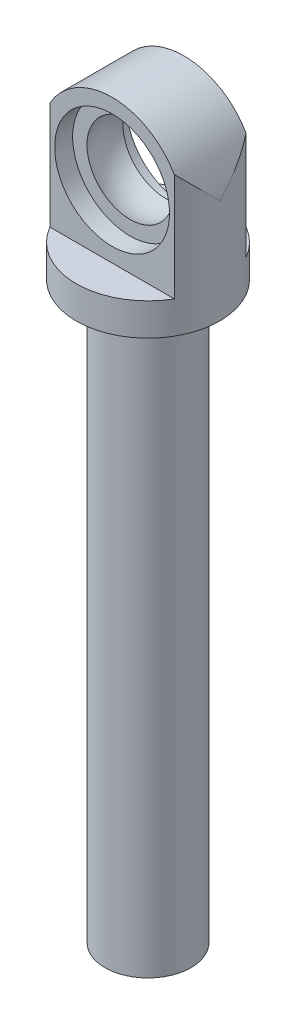
from build123d import *

# Parameters (mm, degrees)
SKETCH_1_R          = 10
EXTRUDE_1_DEPTH     = 4.5
SKETCH_4_R          = 8
EXTRUDE_3_DEPTH     = 5
SKETCH_5_R          = 8
EXTRUDE_4_DEPTH     = 2.5
SKETCH_8_R          = 4
SKETCH_7_R          = 6
SKETCH_9_R          = 14.627232323
SKETCH_9_R_2        = 10
CUT_EXTRUDE_1_DEPTH = 18
SKETCH_10_R         = 2.5
CUT_EXTRUDE_2_DEPTH = 10
SKETCH_2_R          = 6
EXTRUDE_5_DEPTH     = 80
SKETCH_11_R         = 6
CUT_EXTRUDE_3_DEPTH = 36


with BuildPart() as part:
    # 草图1 → 凸台-拉伸1 (new body)
    with BuildSketch(Plane(origin=(0, 0, 0), x_dir=(1, 0, 0), z_dir=(0, 1, 0))):
        with Locations(Location((0, 0, 0), (0, 0, 270))):
            Circle(SKETCH_1_R)
    extrude(amount=EXTRUDE_1_DEPTH)

    # 草图4 → 凸台-拉伸3 (add, symmetric)
    with BuildSketch(Plane.XY):
        with BuildLine():
            Line((-10, 4.5), (10, 4.5))
            Line((10, 4.5), (10, 14.5))
            ThreePointArc((10, 14.5), (0, 24.5), (-10, 14.5))
            Line((-10, 14.5), (-10, 4.5))
        make_face()
        with Locations((0, 14.5)):
            Circle(SKETCH_4_R, mode=Mode.SUBTRACT)
    extrude(amount=EXTRUDE_3_DEPTH, both=True)

    # 草图5 → 凸台-拉伸4 (add, symmetric)
    with BuildSketch(Plane.XY):
        with Locations((0, 14.5)):
            Circle(SKETCH_5_R)
    extrude(amount=EXTRUDE_4_DEPTH, both=True)

    # 草图8 → 放样1 section 0
    with BuildSketch(Plane.XY.offset(4.5)):
        with Locations((0, 14.5)):
            Circle(SKETCH_8_R)
    # 草图7 → 放样1 section 1
    with BuildSketch(Plane.XY.offset(2.5)):
        with Locations((0, 14.5)):
            Circle(SKETCH_7_R)
    loft_1 = loft()

    # 镜向1: 放样1 across plane
    add(loft_1.mirror(Plane.XY))

    # 草图9 → 切除-拉伸1 (cut)
    with BuildSketch(Plane(origin=(0, 4.5, 0), x_dir=(1, 0, 0), z_dir=(0, 1, 0))):
        Circle(SKETCH_9_R)
        with Locations(Location((0, 0, 0), (0, 0, 150))):
            Circle(SKETCH_9_R_2, mode=Mode.SUBTRACT)
    extrude(amount=CUT_EXTRUDE_1_DEPTH, mode=Mode.SUBTRACT)

    # 草图10 → 切除-拉伸2 (cut)
    with BuildSketch(Plane.XY.offset(4.5)):
        with Locations((0, 14.5)):
            Circle(SKETCH_10_R)
    extrude(amount=-CUT_EXTRUDE_2_DEPTH, mode=Mode.SUBTRACT)

    # 草图2 → 凸台-拉伸5 (add)
    with BuildSketch(Plane.XZ):
        with Locations(Location((0, 0, 0), (0, 0, 270))):
            Circle(SKETCH_2_R)
    extrude(amount=EXTRUDE_5_DEPTH)

    # 草图11 → 切除-拉伸3 (cut)
    with BuildSketch(Plane.XY.offset(4.5)):
        with Locations((0, 14.5)):
            Circle(SKETCH_11_R)
    extrude(amount=-CUT_EXTRUDE_3_DEPTH, mode=Mode.SUBTRACT)

    # 草图12 → 切除-旋转1 (revolve, cut)
    with BuildSketch(Plane.XY):
        with BuildLine():
            Line((0, 8), (0, 21))
            ThreePointArc((0, 21), (6.5, 14.5), (0, 8))
        make_face()
    revolve(axis=Axis((0, 8, 0), (0, 1, 0)), mode=Mode.SUBTRACT)


solid = part.part
